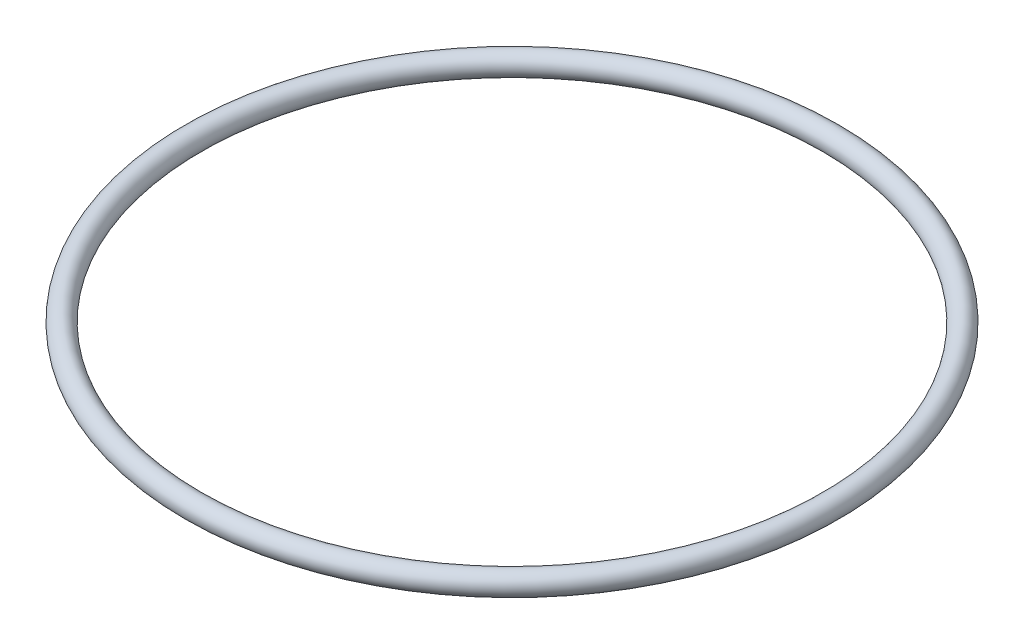
from build123d import *

# Parameters (mm, degrees)
SKETCH1_R = 1.7653


with BuildPart() as part:
    # Sketch1 → Revolve1 (revolve)
    with BuildSketch(Plane.XY, mode=Mode.PRIVATE) as revolve1_sk:
        with Locations((50.9524, 0)):
            Circle(SKETCH1_R)
    revolve(revolve1_sk.sketch.rotate(Axis((0, 0, 0), (0, -1, 0)), 90), axis=Axis((0, 0, 0), (0, -1, 0)))


solid = part.part
